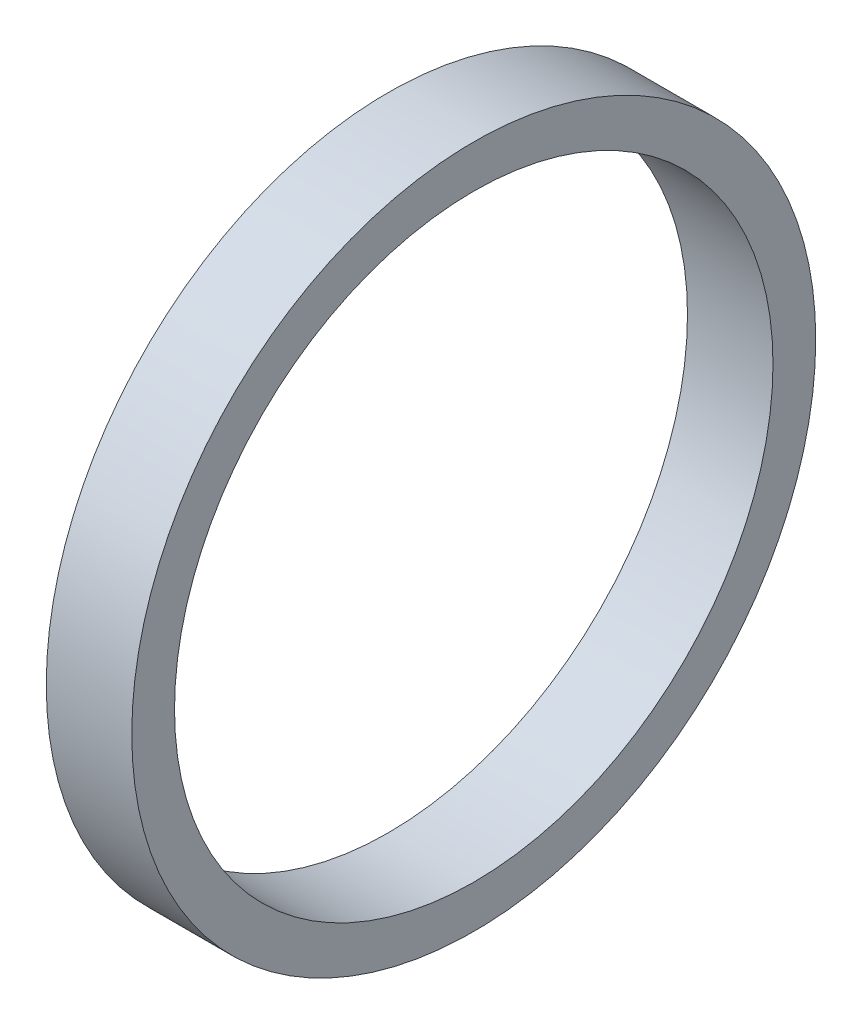
from build123d import *

# Parameters (mm, degrees)
SKETCH1_W = 10
SKETCH1_H = 5


with BuildPart() as part:
    # Sketch1 → Revolve1 (revolve)
    with BuildSketch(Plane.XY, mode=Mode.PRIVATE) as revolve1_sk:
        with Locations((5, 37.5)):
            Rectangle(SKETCH1_W, SKETCH1_H)
    revolve(revolve1_sk.sketch.rotate(Axis((0, 0, 0), (1, 0, 0)), 90), axis=Axis((0, 0, 0), (1, 0, 0)))


solid = part.part
